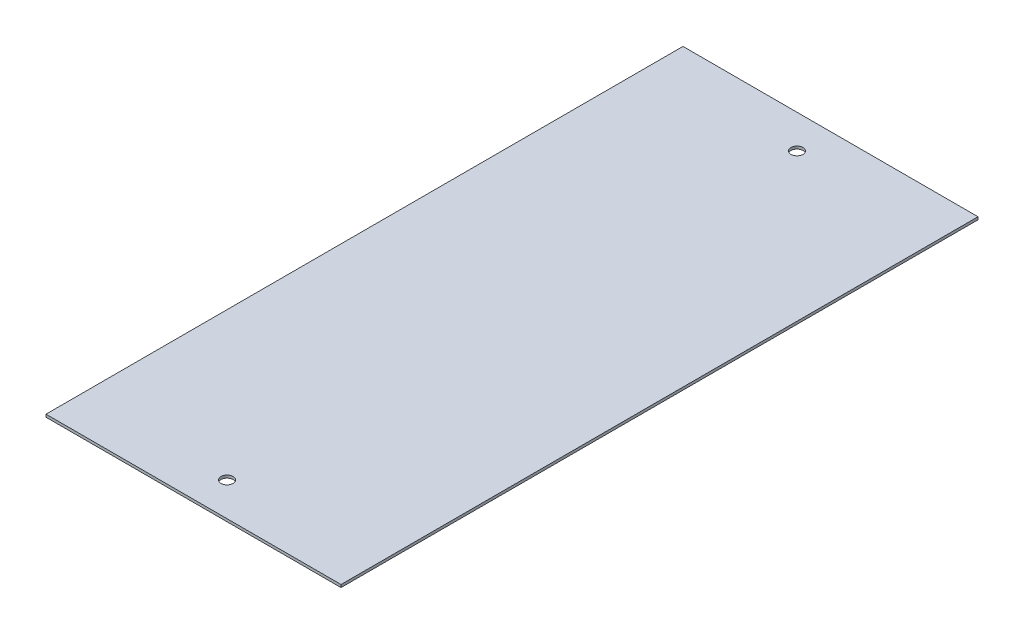
from build123d import *

# Parameters (mm, degrees)
ESBO_O1_W                   = 220
ESBO_O1_H                   = 2
RESSALTO_EXTRUS_O1_DEPTH    = 475
FURO_COM_FOLGA_DE_M81_D     = 9
FURO_COM_FOLGA_DE_M81_DEPTH = 10
FURO_COM_FOLGA_DE_M81_TIP   = 2.703872786


with BuildPart() as part:
    # Esboço1 → Ressalto-extrusão1 (new body)
    with BuildSketch(Plane.XY):
        with Locations((110, 1)):
            Rectangle(ESBO_O1_W, ESBO_O1_H)
    extrude(amount=RESSALTO_EXTRUS_O1_DEPTH)

    # Furo com folga de M81
    with Locations(Plane(origin=(110, 2, 25), x_dir=(0, 0, 1), z_dir=(0, 1, 0))):
        with Locations((0, 0), (425, 0)):
            Hole(FURO_COM_FOLGA_DE_M81_D / 2, depth=FURO_COM_FOLGA_DE_M81_DEPTH)
            with Locations((0, 0, -(FURO_COM_FOLGA_DE_M81_DEPTH + FURO_COM_FOLGA_DE_M81_TIP / 2))):  # 118° drill point
                Cone(0, FURO_COM_FOLGA_DE_M81_D / 2, FURO_COM_FOLGA_DE_M81_TIP, mode=Mode.SUBTRACT)


solid = part.part
